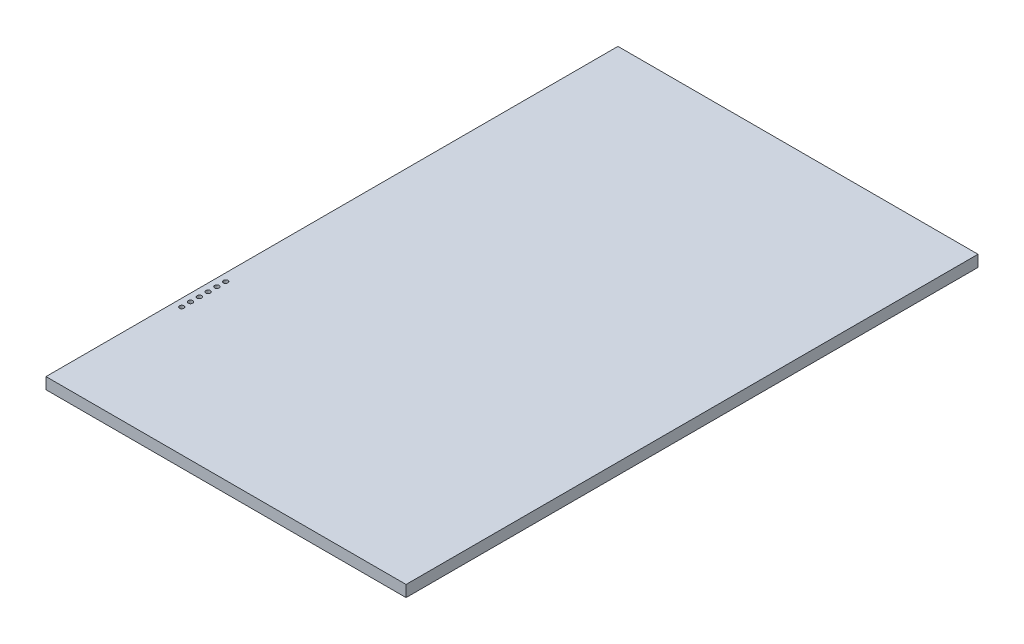
from build123d import *

# Parameters (mm, degrees)
SKETCH1_W           = 52
SKETCH1_H           = 82.6
BOSS_EXTRUDE1_DEPTH = 1.65
SKETCH2_R           = 0.325
CUT_EXTRUDE4_DEPTH  = 98.619068322
LPATTERN1_COUNT     = 6
LPATTERN1_PITCH     = 1.27


with BuildPart() as part:
    # Sketch1 → Boss-Extrude1 (new body)
    with BuildSketch(Plane(origin=(0, 0, 0), x_dir=(1, 0, 0), z_dir=(0, 1, 0))):
        with Locations((26, 41.3)):
            Rectangle(SKETCH1_W, SKETCH1_H)
    extrude(amount=BOSS_EXTRUDE1_DEPTH)

    # Sketch2 → Cut-Extrude4 (cut, through all)
    with BuildSketch(Plane(origin=(0, 0, 0), x_dir=(1, 0, 0), z_dir=(0, 1, 0))):
        with Locations(Location((1.1, 18.5, 0), (0, 0, 270))):
            Circle(SKETCH2_R)
    cut_extrude4 = extrude(amount=CUT_EXTRUDE4_DEPTH, mode=Mode.SUBTRACT)

    # LPattern1: Cut-Extrude4 ×6
    with Locations(*[(0, 0, -i * LPATTERN1_PITCH) for i in range(1, LPATTERN1_COUNT)]):
        add(cut_extrude4, mode=Mode.SUBTRACT)


solid = part.part
